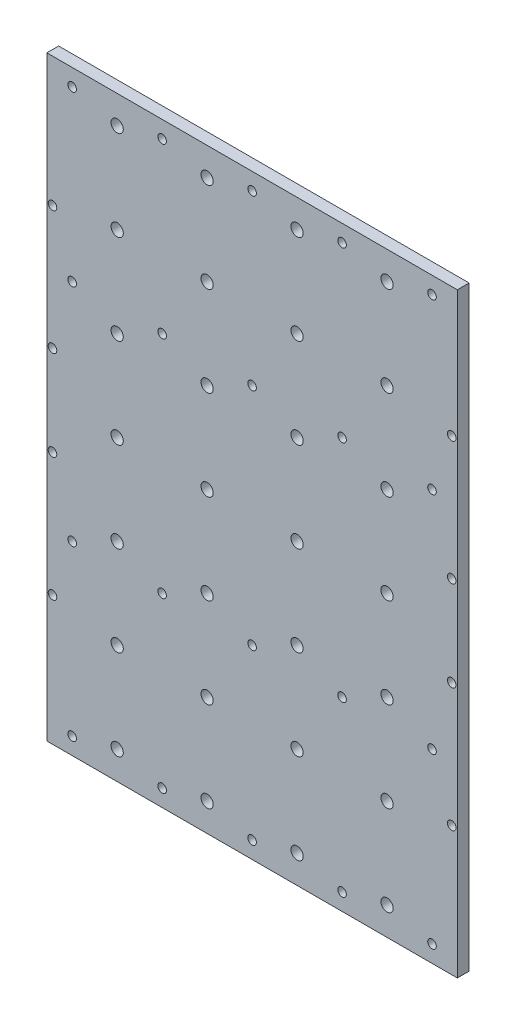
from build123d import *

# Parameters (mm, degrees)
SKIZZE1_W                       = 730
SKIZZE1_H                       = 1060
AUFSATZ_LINEAR_AUSTRAGEN1_DEPTH = 21
SKIZZE2_R                       = 10.899306226
SCHNITT_LINEAR_AUSTRAGEN1_DEPTH = 40
SKIZZE3_R                       = 20.608509003
SCHNITT_LINEAR_AUSTRAGEN2_DEPTH = 5
LINEARES_MUSTER1_COUNT          = 7
LINEARES_MUSTER1_PITCH          = 160
LINEARES_MUSTER1_COUNT_DIR2     = 2
LINEARES_MUSTER1_PITCH_DIR2     = 160
SPIEGELN1_COPY_1_SKETCH_R       = 10.899306226
SPIEGELN1_COPY_1_DEPTH          = 40
SPIEGELN1_COPY_2_SKETCH_R       = 10.899306226
SPIEGELN1_COPY_2_DEPTH          = 40
SPIEGELN1_COPY_3_SKETCH_R       = 10.899306226
SPIEGELN1_COPY_3_DEPTH          = 40
SPIEGELN1_COPY_4_SKETCH_R       = 10.899306226
SPIEGELN1_COPY_4_DEPTH          = 40
SPIEGELN1_COPY_5_SKETCH_R       = 10.899306226
SPIEGELN1_COPY_5_DEPTH          = 40
SPIEGELN1_COPY_6_SKETCH_R       = 10.899306226
SPIEGELN1_COPY_6_DEPTH          = 40
SPIEGELN1_COPY_7_SKETCH_R       = 10.899306226
SPIEGELN1_COPY_7_DEPTH          = 40
SPIEGELN1_COPY_8_SKETCH_R       = 10.899306226
SPIEGELN1_COPY_8_DEPTH          = 40
SPIEGELN1_COPY_9_SKETCH_R       = 10.899306226
SPIEGELN1_COPY_9_DEPTH          = 40
SPIEGELN1_COPY_10_SKETCH_R      = 10.899306226
SPIEGELN1_COPY_10_DEPTH         = 40
SPIEGELN1_COPY_11_SKETCH_R      = 10.899306226
SPIEGELN1_COPY_11_DEPTH         = 40
SPIEGELN1_COPY_12_SKETCH_R      = 10.899306226
SPIEGELN1_COPY_12_DEPTH         = 40
SPIEGELN1_COPY_13_SKETCH_R      = 10.899306226
SPIEGELN1_COPY_13_DEPTH         = 40
SPIEGELN1_COPY_14_SKETCH_R      = 20.608509003
SPIEGELN1_COPY_14_DEPTH         = 5
SPIEGELN1_COPY_15_SKETCH_R      = 20.608509003
SPIEGELN1_COPY_15_DEPTH         = 5
SPIEGELN1_COPY_16_SKETCH_R      = 20.608509003
SPIEGELN1_COPY_16_DEPTH         = 5
SPIEGELN1_COPY_17_SKETCH_R      = 20.608509003
SPIEGELN1_COPY_17_DEPTH         = 5
SPIEGELN1_COPY_18_SKETCH_R      = 20.608509003
SPIEGELN1_COPY_18_DEPTH         = 5
SPIEGELN1_COPY_19_SKETCH_R      = 20.608509003
SPIEGELN1_COPY_19_DEPTH         = 5
SPIEGELN1_COPY_20_SKETCH_R      = 20.608509003
SPIEGELN1_COPY_20_DEPTH         = 5
SPIEGELN1_COPY_21_SKETCH_R      = 20.608509003
SPIEGELN1_COPY_21_DEPTH         = 5
SPIEGELN1_COPY_22_SKETCH_R      = 20.608509003
SPIEGELN1_COPY_22_DEPTH         = 5
SPIEGELN1_COPY_23_SKETCH_R      = 20.608509003
SPIEGELN1_COPY_23_DEPTH         = 5
SPIEGELN1_COPY_24_SKETCH_R      = 20.608509003
SPIEGELN1_COPY_24_DEPTH         = 5
SPIEGELN1_COPY_25_SKETCH_R      = 20.608509003
SPIEGELN1_COPY_25_DEPTH         = 5
SPIEGELN1_COPY_26_SKETCH_R      = 20.608509003
SPIEGELN1_COPY_26_DEPTH         = 5
SKIZZE4_R                       = 7.627
SCHNITT_LINEAR_AUSTRAGEN3_DEPTH = 50


with BuildPart() as part:
    # Skizze1 → Aufsatz-Linear austragen1 (new body)
    with BuildSketch(Plane.XY):
        Rectangle(SKIZZE1_W, SKIZZE1_H)
    extrude(amount=AUFSATZ_LINEAR_AUSTRAGEN1_DEPTH)

    # Skizze2 → Schnitt-Linear austragen1 (cut)
    with BuildSketch(Plane(origin=(0, 0, 0), x_dir=(-1, 0, 0), z_dir=(0, 0, -1))):
        with Locations((80, -480)):
            Circle(SKIZZE2_R)
    schnitt_linear_austragen1 = extrude(amount=-SCHNITT_LINEAR_AUSTRAGEN1_DEPTH, mode=Mode.SUBTRACT)

    # Skizze3 → Schnitt-Linear austragen2 (cut)
    with BuildSketch(Plane(origin=(0, 0, 0), x_dir=(-1, 0, 0), z_dir=(0, 0, -1))):
        with Locations((80, -480)):
            Circle(SKIZZE3_R)
    schnitt_linear_austragen2 = extrude(amount=-SCHNITT_LINEAR_AUSTRAGEN2_DEPTH, mode=Mode.SUBTRACT)

    # Lineares Muster1: Schnitt-Linear austragen1, Schnitt-Linear austragen2 7 × 2
    with Locations(*[(-j * LINEARES_MUSTER1_PITCH_DIR2, i * LINEARES_MUSTER1_PITCH, 0) for i in range(LINEARES_MUSTER1_COUNT) for j in range(LINEARES_MUSTER1_COUNT_DIR2) if (i, j) != (0, 0)]):
        add(schnitt_linear_austragen1, mode=Mode.SUBTRACT)
        add(schnitt_linear_austragen2, mode=Mode.SUBTRACT)

    # Spiegeln1: Schnitt-Linear austragen1, Schnitt-Linear austragen2 across plane
    add(schnitt_linear_austragen1.mirror(Plane(origin=(0, 0, 0), x_dir=(0, 0, 1), z_dir=(1, 0, 0))), mode=Mode.SUBTRACT)
    add(schnitt_linear_austragen2.mirror(Plane(origin=(0, 0, 0), x_dir=(0, 0, 1), z_dir=(1, 0, 0))), mode=Mode.SUBTRACT)

    # Spiegeln1 copy 1 sketch → Spiegeln1 copy 1 (cut)
    with BuildSketch(Plane(origin=(160, 0, 0), x_dir=(1, 0, 0), z_dir=(0, 0, -1))):
        with Locations((80, 480)):
            Circle(SPIEGELN1_COPY_1_SKETCH_R)
    extrude(amount=-SPIEGELN1_COPY_1_DEPTH, mode=Mode.SUBTRACT)

    # Spiegeln1 copy 2 sketch → Spiegeln1 copy 2 (cut)
    with BuildSketch(Plane(origin=(0, 160, 0), x_dir=(1, 0, 0), z_dir=(0, 0, -1))):
        with Locations((80, 480)):
            Circle(SPIEGELN1_COPY_2_SKETCH_R)
    extrude(amount=-SPIEGELN1_COPY_2_DEPTH, mode=Mode.SUBTRACT)

    # Spiegeln1 copy 3 sketch → Spiegeln1 copy 3 (cut)
    with BuildSketch(Plane(origin=(160, 160, 0), x_dir=(1, 0, 0), z_dir=(0, 0, -1))):
        with Locations((80, 480)):
            Circle(SPIEGELN1_COPY_3_SKETCH_R)
    extrude(amount=-SPIEGELN1_COPY_3_DEPTH, mode=Mode.SUBTRACT)

    # Spiegeln1 copy 4 sketch → Spiegeln1 copy 4 (cut)
    with BuildSketch(Plane(origin=(0, 320, 0), x_dir=(1, 0, 0), z_dir=(0, 0, -1))):
        with Locations((80, 480)):
            Circle(SPIEGELN1_COPY_4_SKETCH_R)
    extrude(amount=-SPIEGELN1_COPY_4_DEPTH, mode=Mode.SUBTRACT)

    # Spiegeln1 copy 5 sketch → Spiegeln1 copy 5 (cut)
    with BuildSketch(Plane(origin=(160, 320, 0), x_dir=(1, 0, 0), z_dir=(0, 0, -1))):
        with Locations((80, 480)):
            Circle(SPIEGELN1_COPY_5_SKETCH_R)
    extrude(amount=-SPIEGELN1_COPY_5_DEPTH, mode=Mode.SUBTRACT)

    # Spiegeln1 copy 6 sketch → Spiegeln1 copy 6 (cut)
    with BuildSketch(Plane(origin=(0, 480, 0), x_dir=(1, 0, 0), z_dir=(0, 0, -1))):
        with Locations((80, 480)):
            Circle(SPIEGELN1_COPY_6_SKETCH_R)
    extrude(amount=-SPIEGELN1_COPY_6_DEPTH, mode=Mode.SUBTRACT)

    # Spiegeln1 copy 7 sketch → Spiegeln1 copy 7 (cut)
    with BuildSketch(Plane(origin=(160, 480, 0), x_dir=(1, 0, 0), z_dir=(0, 0, -1))):
        with Locations((80, 480)):
            Circle(SPIEGELN1_COPY_7_SKETCH_R)
    extrude(amount=-SPIEGELN1_COPY_7_DEPTH, mode=Mode.SUBTRACT)

    # Spiegeln1 copy 8 sketch → Spiegeln1 copy 8 (cut)
    with BuildSketch(Plane(origin=(0, 640, 0), x_dir=(1, 0, 0), z_dir=(0, 0, -1))):
        with Locations((80, 480)):
            Circle(SPIEGELN1_COPY_8_SKETCH_R)
    extrude(amount=-SPIEGELN1_COPY_8_DEPTH, mode=Mode.SUBTRACT)

    # Spiegeln1 copy 9 sketch → Spiegeln1 copy 9 (cut)
    with BuildSketch(Plane(origin=(160, 640, 0), x_dir=(1, 0, 0), z_dir=(0, 0, -1))):
        with Locations((80, 480)):
            Circle(SPIEGELN1_COPY_9_SKETCH_R)
    extrude(amount=-SPIEGELN1_COPY_9_DEPTH, mode=Mode.SUBTRACT)

    # Spiegeln1 copy 10 sketch → Spiegeln1 copy 10 (cut)
    with BuildSketch(Plane(origin=(0, 800, 0), x_dir=(1, 0, 0), z_dir=(0, 0, -1))):
        with Locations((80, 480)):
            Circle(SPIEGELN1_COPY_10_SKETCH_R)
    extrude(amount=-SPIEGELN1_COPY_10_DEPTH, mode=Mode.SUBTRACT)

    # Spiegeln1 copy 11 sketch → Spiegeln1 copy 11 (cut)
    with BuildSketch(Plane(origin=(160, 800, 0), x_dir=(1, 0, 0), z_dir=(0, 0, -1))):
        with Locations((80, 480)):
            Circle(SPIEGELN1_COPY_11_SKETCH_R)
    extrude(amount=-SPIEGELN1_COPY_11_DEPTH, mode=Mode.SUBTRACT)

    # Spiegeln1 copy 12 sketch → Spiegeln1 copy 12 (cut)
    with BuildSketch(Plane(origin=(0, 960, 0), x_dir=(1, 0, 0), z_dir=(0, 0, -1))):
        with Locations((80, 480)):
            Circle(SPIEGELN1_COPY_12_SKETCH_R)
    extrude(amount=-SPIEGELN1_COPY_12_DEPTH, mode=Mode.SUBTRACT)

    # Spiegeln1 copy 13 sketch → Spiegeln1 copy 13 (cut)
    with BuildSketch(Plane(origin=(160, 960, 0), x_dir=(1, 0, 0), z_dir=(0, 0, -1))):
        with Locations((80, 480)):
            Circle(SPIEGELN1_COPY_13_SKETCH_R)
    extrude(amount=-SPIEGELN1_COPY_13_DEPTH, mode=Mode.SUBTRACT)

    # Spiegeln1 copy 14 sketch → Spiegeln1 copy 14 (cut)
    with BuildSketch(Plane(origin=(160, 0, 0), x_dir=(1, 0, 0), z_dir=(0, 0, -1))):
        with Locations((80, 480)):
            Circle(SPIEGELN1_COPY_14_SKETCH_R)
    extrude(amount=-SPIEGELN1_COPY_14_DEPTH, mode=Mode.SUBTRACT)

    # Spiegeln1 copy 15 sketch → Spiegeln1 copy 15 (cut)
    with BuildSketch(Plane(origin=(0, 160, 0), x_dir=(1, 0, 0), z_dir=(0, 0, -1))):
        with Locations((80, 480)):
            Circle(SPIEGELN1_COPY_15_SKETCH_R)
    extrude(amount=-SPIEGELN1_COPY_15_DEPTH, mode=Mode.SUBTRACT)

    # Spiegeln1 copy 16 sketch → Spiegeln1 copy 16 (cut)
    with BuildSketch(Plane(origin=(160, 160, 0), x_dir=(1, 0, 0), z_dir=(0, 0, -1))):
        with Locations((80, 480)):
            Circle(SPIEGELN1_COPY_16_SKETCH_R)
    extrude(amount=-SPIEGELN1_COPY_16_DEPTH, mode=Mode.SUBTRACT)

    # Spiegeln1 copy 17 sketch → Spiegeln1 copy 17 (cut)
    with BuildSketch(Plane(origin=(0, 320, 0), x_dir=(1, 0, 0), z_dir=(0, 0, -1))):
        with Locations((80, 480)):
            Circle(SPIEGELN1_COPY_17_SKETCH_R)
    extrude(amount=-SPIEGELN1_COPY_17_DEPTH, mode=Mode.SUBTRACT)

    # Spiegeln1 copy 18 sketch → Spiegeln1 copy 18 (cut)
    with BuildSketch(Plane(origin=(160, 320, 0), x_dir=(1, 0, 0), z_dir=(0, 0, -1))):
        with Locations((80, 480)):
            Circle(SPIEGELN1_COPY_18_SKETCH_R)
    extrude(amount=-SPIEGELN1_COPY_18_DEPTH, mode=Mode.SUBTRACT)

    # Spiegeln1 copy 19 sketch → Spiegeln1 copy 19 (cut)
    with BuildSketch(Plane(origin=(0, 480, 0), x_dir=(1, 0, 0), z_dir=(0, 0, -1))):
        with Locations((80, 480)):
            Circle(SPIEGELN1_COPY_19_SKETCH_R)
    extrude(amount=-SPIEGELN1_COPY_19_DEPTH, mode=Mode.SUBTRACT)

    # Spiegeln1 copy 20 sketch → Spiegeln1 copy 20 (cut)
    with BuildSketch(Plane(origin=(160, 480, 0), x_dir=(1, 0, 0), z_dir=(0, 0, -1))):
        with Locations((80, 480)):
            Circle(SPIEGELN1_COPY_20_SKETCH_R)
    extrude(amount=-SPIEGELN1_COPY_20_DEPTH, mode=Mode.SUBTRACT)

    # Spiegeln1 copy 21 sketch → Spiegeln1 copy 21 (cut)
    with BuildSketch(Plane(origin=(0, 640, 0), x_dir=(1, 0, 0), z_dir=(0, 0, -1))):
        with Locations((80, 480)):
            Circle(SPIEGELN1_COPY_21_SKETCH_R)
    extrude(amount=-SPIEGELN1_COPY_21_DEPTH, mode=Mode.SUBTRACT)

    # Spiegeln1 copy 22 sketch → Spiegeln1 copy 22 (cut)
    with BuildSketch(Plane(origin=(160, 640, 0), x_dir=(1, 0, 0), z_dir=(0, 0, -1))):
        with Locations((80, 480)):
            Circle(SPIEGELN1_COPY_22_SKETCH_R)
    extrude(amount=-SPIEGELN1_COPY_22_DEPTH, mode=Mode.SUBTRACT)

    # Spiegeln1 copy 23 sketch → Spiegeln1 copy 23 (cut)
    with BuildSketch(Plane(origin=(0, 800, 0), x_dir=(1, 0, 0), z_dir=(0, 0, -1))):
        with Locations((80, 480)):
            Circle(SPIEGELN1_COPY_23_SKETCH_R)
    extrude(amount=-SPIEGELN1_COPY_23_DEPTH, mode=Mode.SUBTRACT)

    # Spiegeln1 copy 24 sketch → Spiegeln1 copy 24 (cut)
    with BuildSketch(Plane(origin=(160, 800, 0), x_dir=(1, 0, 0), z_dir=(0, 0, -1))):
        with Locations((80, 480)):
            Circle(SPIEGELN1_COPY_24_SKETCH_R)
    extrude(amount=-SPIEGELN1_COPY_24_DEPTH, mode=Mode.SUBTRACT)

    # Spiegeln1 copy 25 sketch → Spiegeln1 copy 25 (cut)
    with BuildSketch(Plane(origin=(0, 960, 0), x_dir=(1, 0, 0), z_dir=(0, 0, -1))):
        with Locations((80, 480)):
            Circle(SPIEGELN1_COPY_25_SKETCH_R)
    extrude(amount=-SPIEGELN1_COPY_25_DEPTH, mode=Mode.SUBTRACT)

    # Spiegeln1 copy 26 sketch → Spiegeln1 copy 26 (cut)
    with BuildSketch(Plane(origin=(160, 960, 0), x_dir=(1, 0, 0), z_dir=(0, 0, -1))):
        with Locations((80, 480)):
            Circle(SPIEGELN1_COPY_26_SKETCH_R)
    extrude(amount=-SPIEGELN1_COPY_26_DEPTH, mode=Mode.SUBTRACT)

    # Skizze4 → Schnitt-Linear austragen3 (cut)
    with BuildSketch(Plane.XY.offset(21)):
        with Locations((0, -500)):
            Circle(SKIZZE4_R)
        with Locations((160, -500)):
            Circle(SKIZZE4_R)
        with Locations((320, -500)):
            Circle(SKIZZE4_R)
        with Locations(Location((-160, -500, 0), (0, 0, 180))):
            Circle(SKIZZE4_R)
        with Locations(Location((-320, -500, 0), (0, 0, 180))):
            Circle(SKIZZE4_R)
        with Locations((355, -300)):
            Circle(SKIZZE4_R)
        with Locations((355, -80)):
            Circle(SKIZZE4_R)
        with Locations(Location((-355, -80, 0), (0, 0, 180))):
            Circle(SKIZZE4_R)
        with Locations(Location((-355, -300, 0), (0, 0, 180))):
            Circle(SKIZZE4_R)
        with Locations(Location((355, 80, 0), (0, 0, 180))):
            Circle(SKIZZE4_R)
        with Locations(Location((355, 300, 0), (0, 0, 180))):
            Circle(SKIZZE4_R)
        with Locations(Location((320, 500, 0), (0, 0, 180))):
            Circle(SKIZZE4_R)
        with Locations(Location((160, 500, 0), (0, 0, 180))):
            Circle(SKIZZE4_R)
        with Locations(Location((0, 500, 0), (0, 0, 180))):
            Circle(SKIZZE4_R)
        with Locations((-355, 300)):
            Circle(SKIZZE4_R)
        with Locations((-355, 80)):
            Circle(SKIZZE4_R)
        with Locations((-320, 500)):
            Circle(SKIZZE4_R)
        with Locations((-160, 500)):
            Circle(SKIZZE4_R)
        with Locations((160, -200)):
            Circle(SKIZZE4_R)
        with Locations((320, -200)):
            Circle(SKIZZE4_R)
        with Locations((0, -200)):
            Circle(SKIZZE4_R)
        with Locations(Location((-160, -200, 0), (0, 0, 180))):
            Circle(SKIZZE4_R)
        with Locations(Location((-320, -200, 0), (0, 0, 180))):
            Circle(SKIZZE4_R)
        with Locations(Location((320, 200, 0), (0, 0, 180))):
            Circle(SKIZZE4_R)
        with Locations(Location((160, 200, 0), (0, 0, 180))):
            Circle(SKIZZE4_R)
        with Locations(Location((0, 200, 0), (0, 0, 180))):
            Circle(SKIZZE4_R)
        with Locations((-160, 200)):
            Circle(SKIZZE4_R)
        with Locations((-320, 200)):
            Circle(SKIZZE4_R)
    extrude(amount=-SCHNITT_LINEAR_AUSTRAGEN3_DEPTH, mode=Mode.SUBTRACT)


solid = part.part
